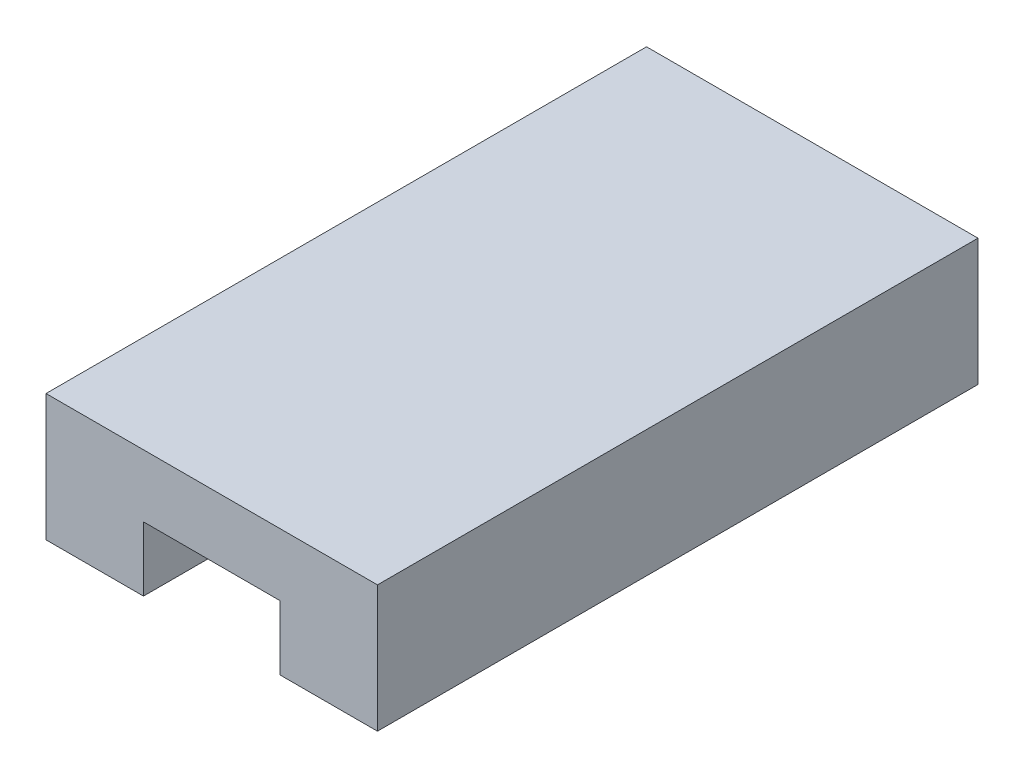
from build123d import *

# Parameters (mm, degrees)
BOSS_EXTRUDE1_DEPTH = 15.4


with BuildPart() as part:
    # Sketch1 → Boss-Extrude1 (new, symmetric)
    with BuildSketch(Plane.XY):
        Polygon((3.5, 2.4), (3.5, -0.9), (8.5, -0.9), (8.5, 5.6), (-8.5, 5.6), (-8.5, -0.9), (-3.5, -0.9), (-3.5, 2.4), align=None)
    extrude(amount=BOSS_EXTRUDE1_DEPTH, both=True)


solid = part.part
